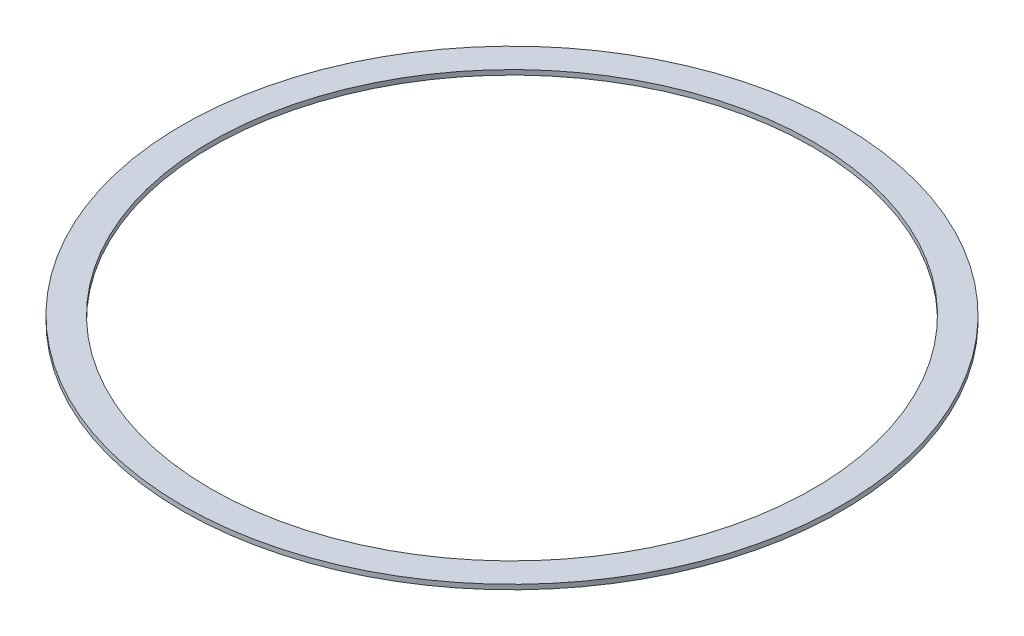
from build123d import *

# Parameters (mm, degrees)
SKETCH1_R           = 175.26
SKETCH1_R_2         = 160.02
BOSS_EXTRUDE1_DEPTH = 2.54


with BuildPart() as part:
    # Sketch1 → Boss-Extrude1 (new body)
    with BuildSketch(Plane(origin=(0, 0, 0), x_dir=(1, 0, 0), z_dir=(0, 1, 0))):
        with Locations(Location((-843.703209975, -2673.068972226, 0), (0, 0, 270))):
            Circle(SKETCH1_R)
        with Locations(Location((-843.703209975, -2673.068972226, 0), (0, 0, 270))):
            Circle(SKETCH1_R_2, mode=Mode.SUBTRACT)
    extrude(amount=BOSS_EXTRUDE1_DEPTH)


solid = part.part
